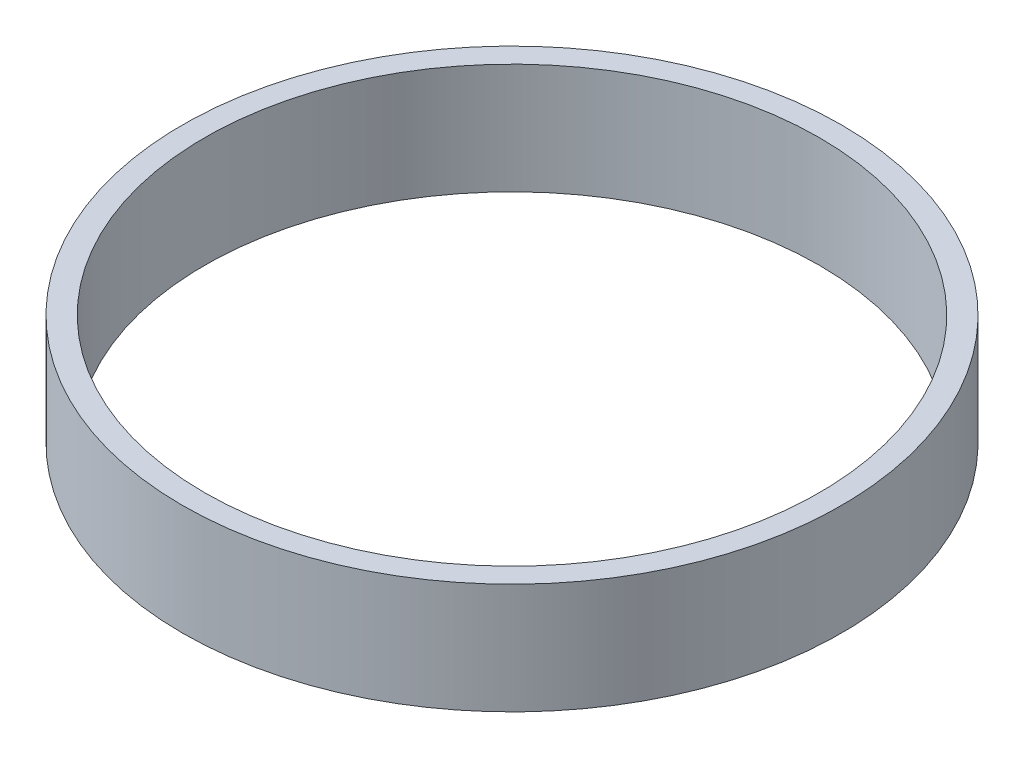
from build123d import *

# Parameters (mm, degrees)
SKETCH4_R           = 29.8
SKETCH4_R_2         = 27.8
BOSS_EXTRUDE1_DEPTH = 10


with BuildPart() as part:
    # Sketch4 → Boss-Extrude1 (new body)
    with BuildSketch(Plane(origin=(0, 0, 0), x_dir=(1, 0, 0), z_dir=(0, 1, 0))):
        with Locations(Location((99.414918564, 12.389800084, 0), (0, 0, 270))):
            Circle(SKETCH4_R)
        with Locations(Location((99.414918564, 12.389800084, 0), (0, 0, 270))):
            Circle(SKETCH4_R_2, mode=Mode.SUBTRACT)
    extrude(amount=BOSS_EXTRUDE1_DEPTH)


solid = part.part
